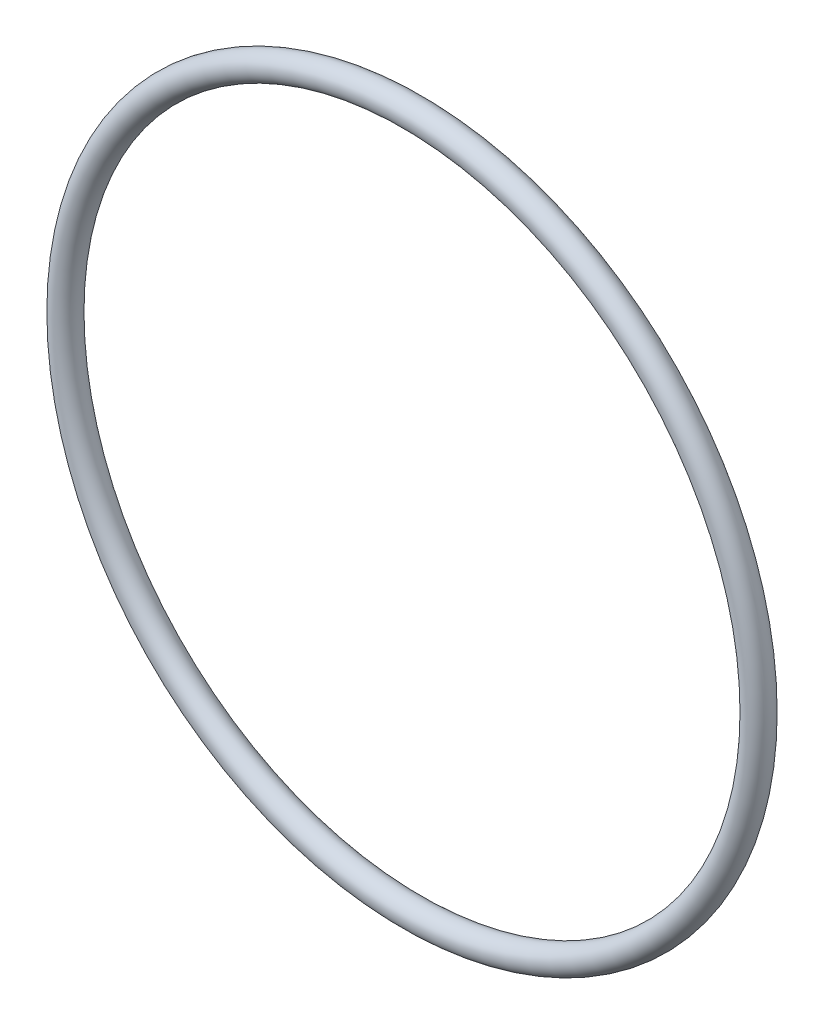
from build123d import *

# Parameters (mm, degrees)
SKETCH1_R = 3.4925


with BuildPart() as part:
    # Sketch1 → Revolve1 (revolve)
    with BuildSketch(Plane(origin=(0, 0, 0), x_dir=(0, -1, 0), z_dir=(1, 0, 0)), mode=Mode.PRIVATE) as revolve1_sk:
        with Locations((92.075, 0)):
            Circle(SKETCH1_R)
    revolve(revolve1_sk.sketch.rotate(Axis((0, 0, 3.4925), (0, 0, -1)), 270), axis=Axis((0, 0, 3.4925), (0, 0, -1)))


solid = part.part
